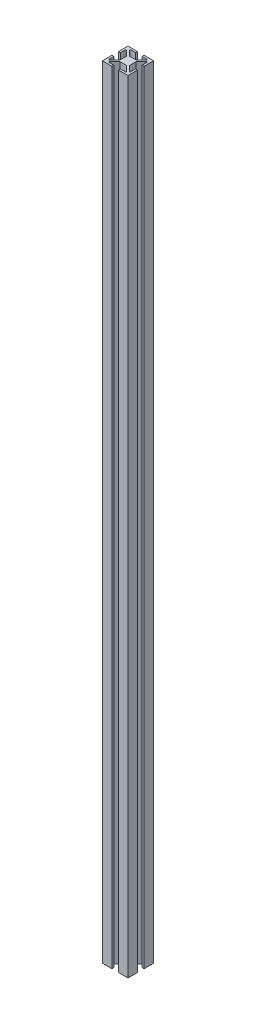
from build123d import *

# Parameters (mm, degrees)
BOSS_EXTRU_1_DEPTH = 610


with BuildPart() as part:
    # Esquisse1 → Boss.-Extru.1 (new body)
    with BuildSketch(Plane(origin=(0, 0, 0), x_dir=(1, 0, 0), z_dir=(0, 1, 0))):
        with BuildLine():
            Line((-10, -2.5), (-10, -10))
            Line((-10, -10), (-2.5, -10))
            Line((-2.5, -10), (-2.5, -8.5))
            Line((-2.5, -8.5), (-6.232233047, -8.5))
            ThreePointArc((-6.232233047, -8.5), (-6.694172813, -8.191341716), (-6.585786438, -7.646446609))
            Line((-6.585786438, -7.646446609), (-2.689339828, -3.75))
            Line((-2.689339828, -3.75), (2.689339828, -3.75))
            Line((2.689339828, -3.75), (6.585786438, -7.646446609))
            ThreePointArc((6.585786438, -7.646446609), (6.694172813, -8.191341716), (6.232233047, -8.5))
            Line((6.232233047, -8.5), (2.5, -8.5))
            Line((2.5, -8.5), (2.5, -10))
            Line((2.5, -10), (10, -10))
            Line((10, -10), (10, -2.5))
            Line((10, -2.5), (8.5, -2.5))
            Line((8.5, -2.5), (8.5, -6.232233047))
            ThreePointArc((8.5, -6.232233047), (8.191341716, -6.694172813), (7.646446609, -6.585786438))
            Line((7.646446609, -6.585786438), (3.75, -2.689339828))
            Line((3.75, -2.689339828), (3.75, 2.689339828))
            Line((3.75, 2.689339828), (7.646446609, 6.585786438))
            ThreePointArc((7.646446609, 6.585786438), (8.191341716, 6.694172813), (8.5, 6.232233047))
            Line((8.5, 6.232233047), (8.5, 2.5))
            Line((8.5, 2.5), (10, 2.5))
            Line((10, 2.5), (10, 10))
            Line((10, 10), (2.5, 10))
            Line((2.5, 10), (2.5, 8.5))
            Line((2.5, 8.5), (6.232233047, 8.5))
            ThreePointArc((6.232233047, 8.5), (6.694172813, 8.191341716), (6.585786438, 7.646446609))
            Line((6.585786438, 7.646446609), (2.689339828, 3.75))
            Line((2.689339828, 3.75), (-2.689339828, 3.75))
            Line((-2.689339828, 3.75), (-6.585786438, 7.646446609))
            ThreePointArc((-6.585786438, 7.646446609), (-6.694172813, 8.191341716), (-6.232233047, 8.5))
            Line((-6.232233047, 8.5), (-2.5, 8.5))
            Line((-2.5, 8.5), (-2.5, 10))
            Line((-2.5, 10), (-10, 10))
            Line((-10, 10), (-10, 2.5))
            Line((-10, 2.5), (-8.5, 2.5))
            Line((-8.5, 2.5), (-8.5, 6.232233047))
            ThreePointArc((-8.5, 6.232233047), (-8.191341716, 6.694172813), (-7.646446609, 6.585786438))
            Line((-7.646446609, 6.585786438), (-3.75, 2.689339828))
            Line((-3.75, 2.689339828), (-3.75, -2.689339828))
            Line((-3.75, -2.689339828), (-7.646446609, -6.585786438))
            ThreePointArc((-7.646446609, -6.585786438), (-8.191341716, -6.694172813), (-8.5, -6.232233047))
            Line((-8.5, -6.232233047), (-8.5, -2.5))
            Line((-8.5, -2.5), (-10, -2.5))
        make_face()
    extrude(amount=BOSS_EXTRU_1_DEPTH)


solid = part.part
